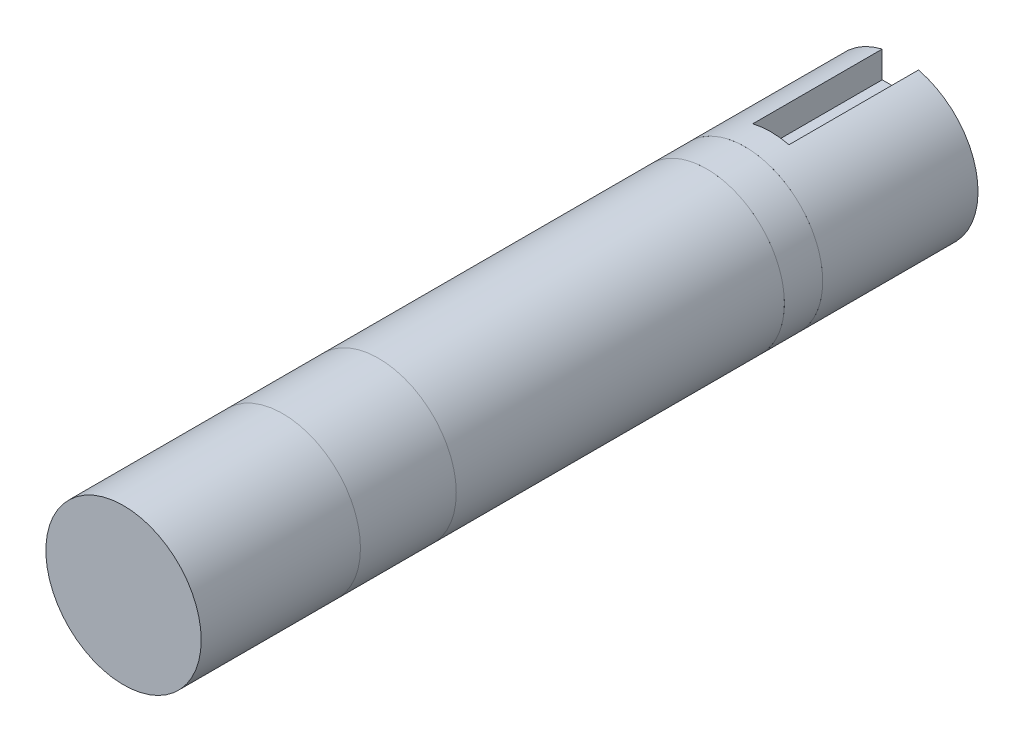
from build123d import *

# Parameters (mm, degrees)
SKETCH1_R           = 150
BOSS_EXTRUDE1_DEPTH = 1500
SKETCH3_W           = 70
SKETCH3_H           = 70
CUT_EXTRUDE2_DEPTH  = 250
SKETCH7_R           = 150
SKETCH7_R_2         = 149.9999
EXTRUDE_THIN1_DEPTH = 92.5
EXTRUDE_THIN2_START = -74
SKETCH8_R           = 150
SKETCH8_R_2         = 149.9999
EXTRUDE_THIN2_DEPTH = 74


with BuildPart() as part:
    # Sketch1 → Boss-Extrude1 (new body)
    with BuildSketch(Plane.XY):
        Circle(SKETCH1_R)
    extrude(amount=-BOSS_EXTRUDE1_DEPTH)

    # Sketch3 → Cut-Extrude2 (cut)
    with BuildSketch(Plane(origin=(0, 0, -1500), x_dir=(-1, 0, 0), z_dir=(0, 0, -1))):
        with Locations((0, 129.4)):
            Rectangle(SKETCH3_W, SKETCH3_H)
    extrude(amount=-CUT_EXTRUDE2_DEPTH, mode=Mode.SUBTRACT)

    # Sketch7 → Extrude-Thin1 (add, symmetric)
    with BuildSketch(Plane.XY.offset(-400)):
        Circle(SKETCH7_R)
        Circle(SKETCH7_R_2, mode=Mode.SUBTRACT)
    extrude(amount=EXTRUDE_THIN1_DEPTH, both=True)

    # Sketch8 → Extrude-Thin2 (add)
    with BuildSketch(Plane(origin=(0, 0, -1200), x_dir=(-1, 0, 0), z_dir=(0, 0, -1)).offset(EXTRUDE_THIN2_START)):
        Circle(SKETCH8_R)
        Circle(SKETCH8_R_2, mode=Mode.SUBTRACT)
    extrude(amount=EXTRUDE_THIN2_DEPTH)


solid = part.part
